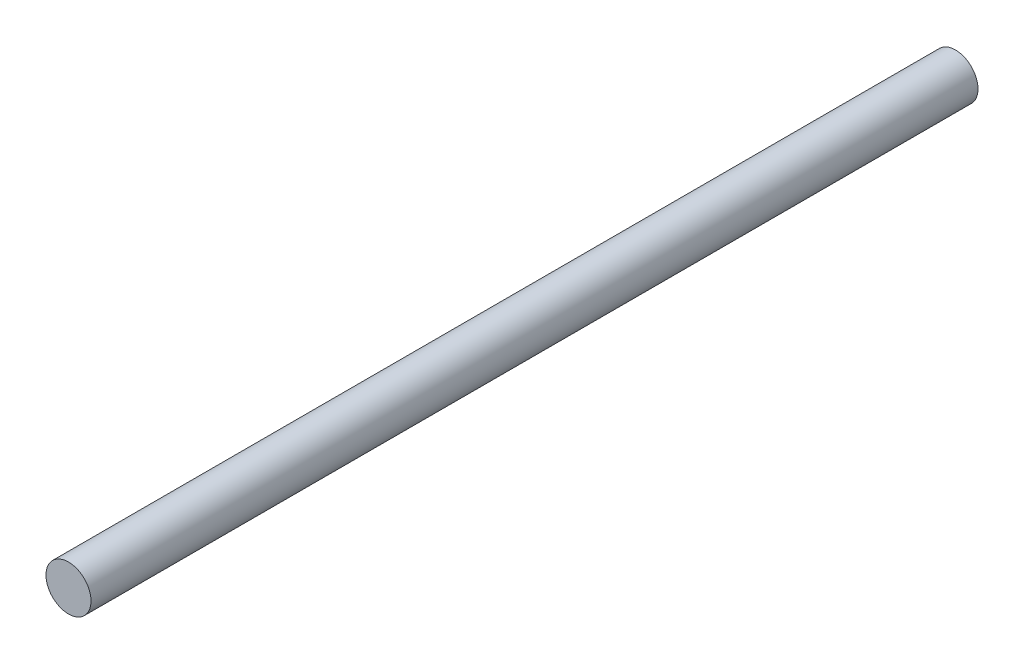
from build123d import *

# Parameters (mm, degrees)
SKETCH2_R           = 6.35
BOSS_EXTRUDE1_DEPTH = 250


with BuildPart() as part:
    # Sketch2 → Boss-Extrude1 (new body)
    with BuildSketch(Plane.XY):
        Circle(SKETCH2_R)
    extrude(amount=BOSS_EXTRUDE1_DEPTH)


solid = part.part
